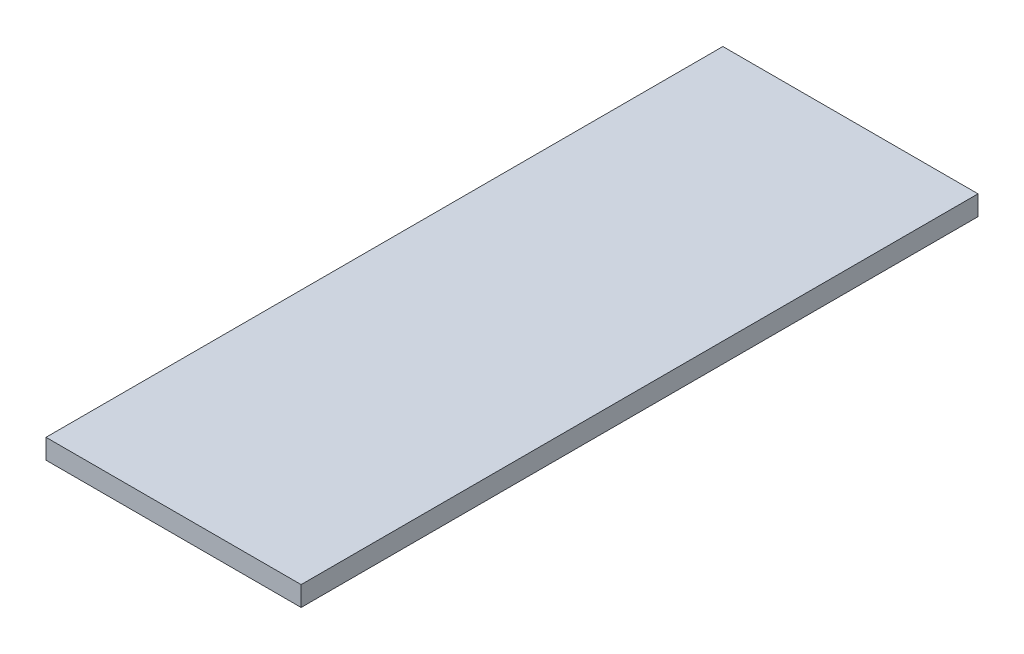
from build123d import *

# Parameters (mm, degrees)
SKETCH1_W           = 245
SKETCH1_H           = 650
BOSS_EXTRUDE1_DEPTH = 19.05


with BuildPart() as part:
    # Sketch1 → Boss-Extrude1 (new body)
    with BuildSketch(Plane(origin=(0, 0, 0), x_dir=(1, 0, 0), z_dir=(0, 1, 0))):
        Rectangle(SKETCH1_W, SKETCH1_H)
    extrude(amount=BOSS_EXTRUDE1_DEPTH)


solid = part.part
